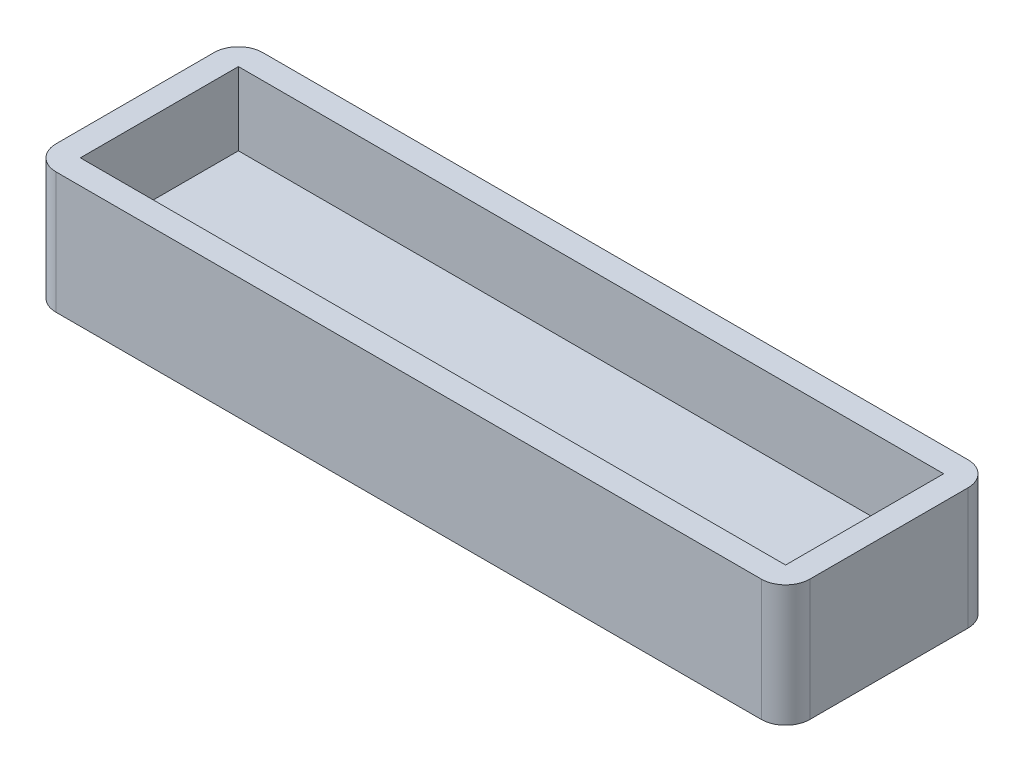
from build123d import *

# Parameters (mm, degrees)
SKIZZE2_W                       = 310
SKIZZE2_H                       = 50
AUFSATZ_LINEAR_AUSTRAGEN1_DEPTH = 85
SKIZZE4_W                       = 290
SKIZZE4_H                       = 65
SCHNITT_LINEAR_AUSTRAGEN1_DEPTH = 30
VERRUNDUNG1_R                   = 10
VERRUNDUNG2_R                   = 10
VERRUNDUNG3_R                   = 10
VERRUNDUNG4_R                   = 10
SKIZZE9_W                       = 8
SKIZZE9_H                       = 4
SCHNITT_LINEAR_AUSTRAGEN2_DEPTH = 10
SKIZZE10_R                      = 1.5
SCHNITT_LINEAR_AUSTRAGEN3_DEPTH = 6


with BuildPart() as part:
    # Skizze2 → Aufsatz-Linear austragen1 (new body)
    with BuildSketch(Plane.XY):
        with Locations((155, 25)):
            Rectangle(SKIZZE2_W, SKIZZE2_H)
    extrude(amount=AUFSATZ_LINEAR_AUSTRAGEN1_DEPTH)

    # Skizze4 → Schnitt-Linear austragen1 (cut)
    with BuildSketch(Plane(origin=(0, 50, 0), x_dir=(1, 0, 0), z_dir=(0, 1, 0))):
        with Locations((155, -42.5)):
            Rectangle(SKIZZE4_W, SKIZZE4_H)
    extrude(amount=-SCHNITT_LINEAR_AUSTRAGEN1_DEPTH, mode=Mode.SUBTRACT)

    # Verrundung1
    verrundung1_edges = [part.edges().sort_by_distance(p)[0] for p in [
        (310, 25, 0),
    ]]
    fillet(verrundung1_edges, radius=VERRUNDUNG1_R)

    # Verrundung2
    verrundung2_edges = [part.edges().sort_by_distance(p)[0] for p in [
        (310, 25, 85),
    ]]
    fillet(verrundung2_edges, radius=VERRUNDUNG2_R)

    # Verrundung3
    verrundung3_edges = [part.edges().sort_by_distance(p)[0] for p in [
        (0, 25, 85),
    ]]
    fillet(verrundung3_edges, radius=VERRUNDUNG3_R)

    # Verrundung4
    verrundung4_edges = [part.edges().sort_by_distance(p)[0] for p in [
        (0, 25, 0),
    ]]
    fillet(verrundung4_edges, radius=VERRUNDUNG4_R)

    # Skizze9 → Schnitt-Linear austragen2 (cut)
    with BuildSketch(Plane(origin=(0, 0, 0), x_dir=(-1, 0, 0), z_dir=(0, 0, -1))):
        with Locations((-286, 27)):
            Rectangle(SKIZZE9_W, SKIZZE9_H)
    extrude(amount=-SCHNITT_LINEAR_AUSTRAGEN2_DEPTH, mode=Mode.SUBTRACT)

    # Skizze10 → Schnitt-Linear austragen3 (cut)
    with BuildSketch(Plane(origin=(0, 20, 0), x_dir=(1, 0, 0), z_dir=(0, 1, 0))):
        with Locations(Location((286, -15, 0), (0, 0, 270))):
            Circle(SKIZZE10_R)
        with Locations(Location((286, -70, 0), (0, 0, 270))):
            Circle(SKIZZE10_R)
    extrude(amount=-SCHNITT_LINEAR_AUSTRAGEN3_DEPTH, mode=Mode.SUBTRACT)


solid = part.part
